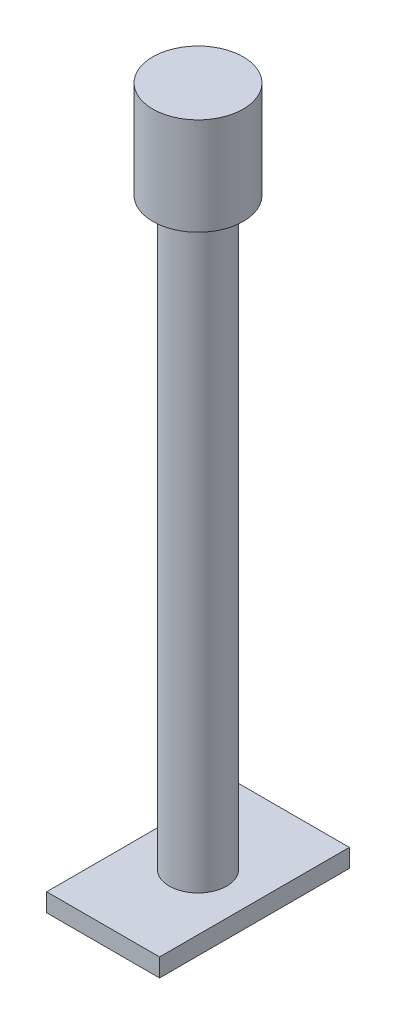
from build123d import *

# Parameters (mm, degrees)
SKETCH1_R           = 7.493
BOSS_EXTRUDE1_DEPTH = 152.4
SKETCH2_W           = 29.464
SKETCH2_H           = 49.53
BOSS_EXTRUDE2_DEPTH = 4.7625
SKETCH3_R           = 11.811
BOSS_EXTRUDE3_DEPTH = 25.4


with BuildPart() as part:
    # Sketch1 → Boss-Extrude1 (new body)
    with BuildSketch(Plane(origin=(0, 0, 0), x_dir=(1, 0, 0), z_dir=(0, 1, 0))):
        with Locations(Location((0, 0, 0), (0, 0, 90))):
            Circle(SKETCH1_R)
    extrude(amount=BOSS_EXTRUDE1_DEPTH)

    # Sketch2 → Boss-Extrude2 (add)
    with BuildSketch(Plane.XZ):
        Rectangle(SKETCH2_W, SKETCH2_H)
    extrude(amount=BOSS_EXTRUDE2_DEPTH)

    # Sketch3 → Boss-Extrude3 (add)
    with BuildSketch(Plane(origin=(0, 152.4, 0), x_dir=(1, 0, 0), z_dir=(0, 1, 0))):
        with Locations(Location((0, 0, 0), (0, 0, 270))):
            Circle(SKETCH3_R)
    extrude(amount=BOSS_EXTRUDE3_DEPTH)


solid = part.part
